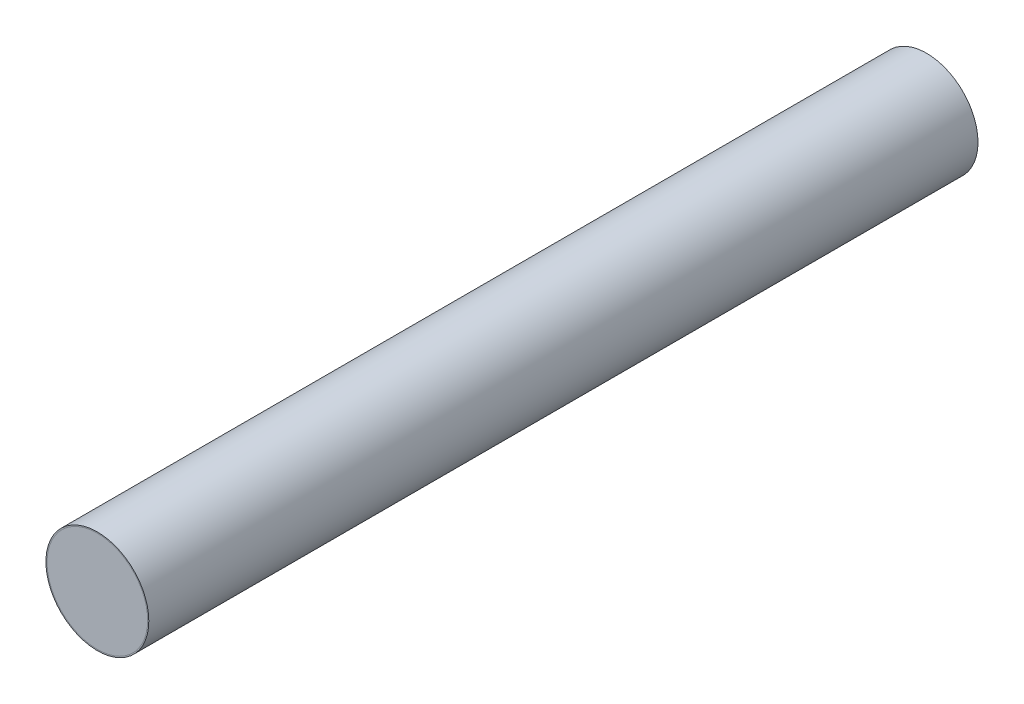
from build123d import *

# Parameters (mm, degrees)
SKETCH1_R           = 16.5481
SKETCH1_R_2         = 16.1798
BOSS_EXTRUDE1_DEPTH = 266.7
SKETCH2_R           = 16.1798
BOSS_EXTRUDE2_DEPTH = 266.7


with BuildPart() as part:
    # Sketch1 → Boss-Extrude1 (new body)
    with BuildSketch(Plane.XY):
        Circle(SKETCH1_R)
        Circle(SKETCH1_R_2, mode=Mode.SUBTRACT)
    extrude(amount=BOSS_EXTRUDE1_DEPTH)


with BuildPart() as body_2:
    # Sketch2 → Boss-Extrude2 (new body)
    with BuildSketch(Plane.XY):
        Circle(SKETCH2_R)
    extrude(amount=BOSS_EXTRUDE2_DEPTH)


solid = Compound([part.part, body_2.part])
